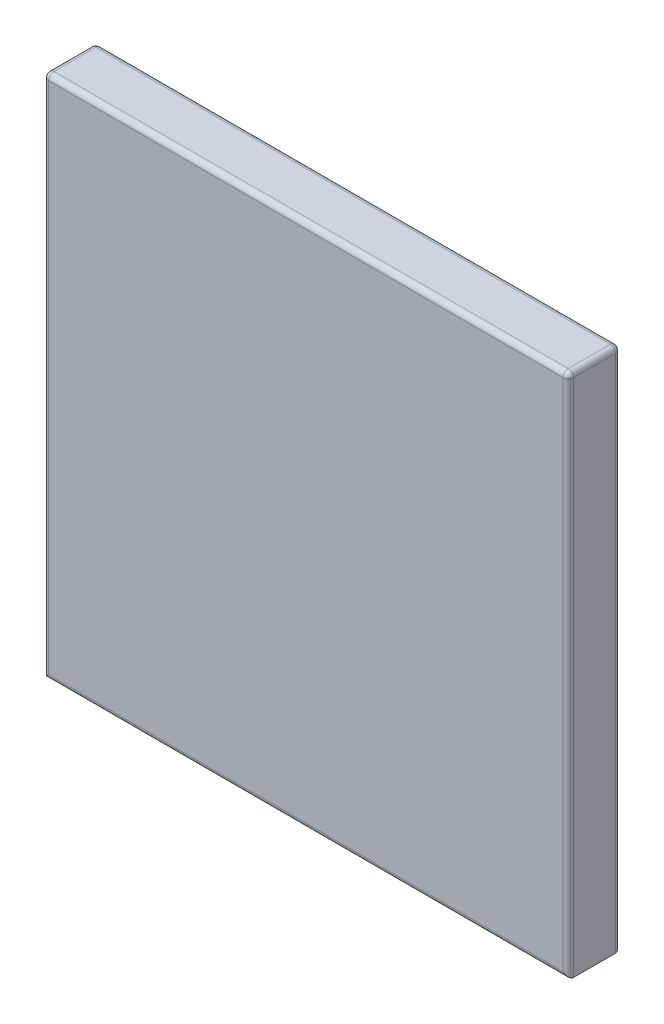
from build123d import *

# Parameters (mm, degrees)
SKETCH1_W           = 100
SKETCH1_H           = 100
BOSS_EXTRUDE1_DEPTH = 10
FILLET2_R           = 1
FILLET3_R           = 1
FILLET5_R           = 1


with BuildPart() as part:
    # Sketch1 → Boss-Extrude1 (new body)
    with BuildSketch(Plane.XY):
        Rectangle(SKETCH1_W, SKETCH1_H)
    extrude(amount=BOSS_EXTRUDE1_DEPTH)

    # Fillet2
    fillet2_edges = [part.edges().sort_by_distance(p)[0] for p in [
        (0, 50, 10),
    ]]
    fillet(fillet2_edges, radius=FILLET2_R)

    # Fillet3
    fillet3_edges = [part.edges().sort_by_distance(p)[0] for p in [
        (0, 50, 0),
    ]]
    fillet(fillet3_edges, radius=FILLET3_R)

    # Fillet5
    fillet5_edges = [part.edges().sort_by_distance(p)[0] for p in [
        (-50, -0.5, 10),
        (-50, 50, 5),
        (-50, 49.707106781, 9.707106781),
        (50, 50, 5),
        (50, 49.707106781, 9.707106781),
        (0, -50, 10),
        (-50, -0.5, 0),
        (-50, 49.707106781, 0.292893219),
        (50, 49.707106781, 0.292893219),
        (50, -0.5, 10),
        (0, -50, 0),
        (50, -0.5, 0),
    ]]
    fillet(fillet5_edges, radius=FILLET5_R)


solid = part.part
